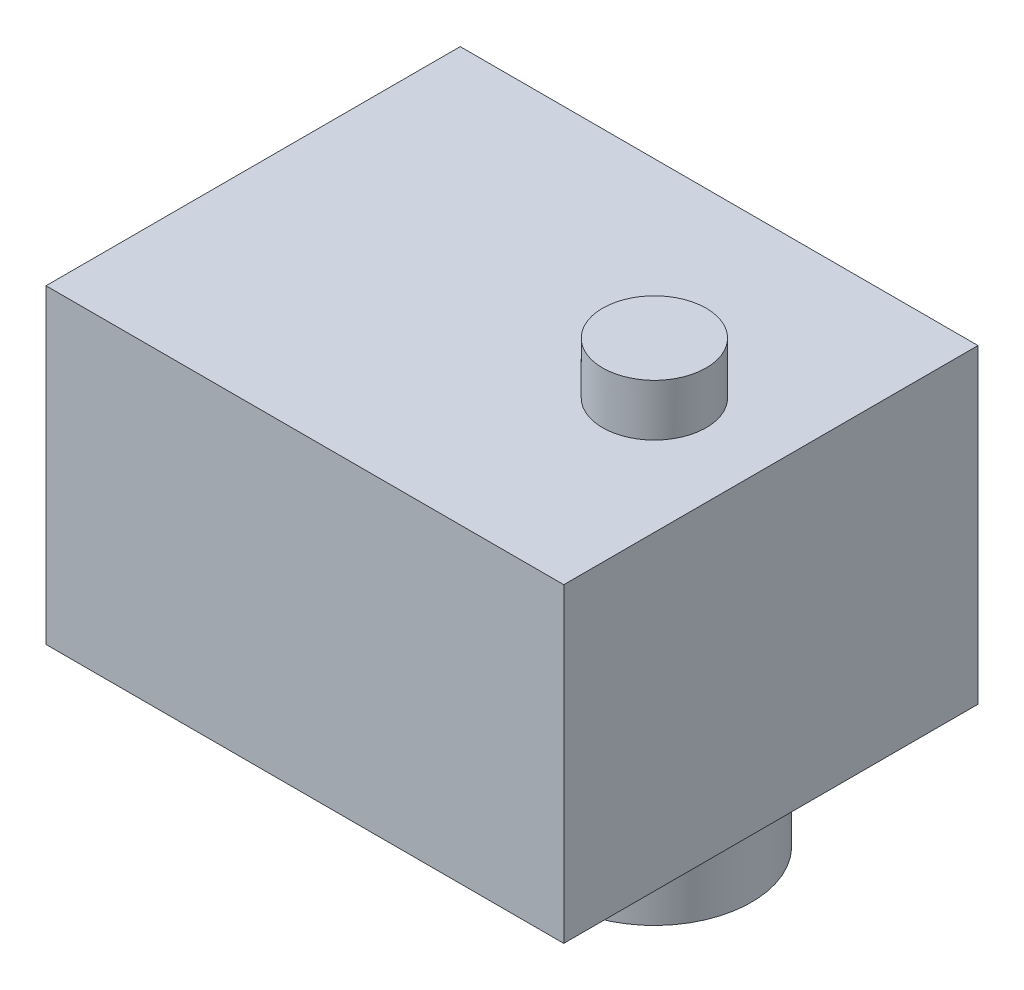
from build123d import *

# Parameters (mm, degrees)
SKETCH_1_W      = 20
SKETCH_1_H      = 16
EXTRUDE_1_DEPTH = 12
SKETCH_2_R      = 2
EXTRUDE_2_DEPTH = 2
SKETCH_3_R      = 3.75
EXTRUDE_3_DEPTH = 3
SKETCH_4_R      = 2
EXTRUDE_4_DEPTH = 2
EXTRUDE_4_TAPER = 30


with BuildPart() as part:
    # Эскиз1 → Бобышка-Вытянуть1 (new body)
    with BuildSketch(Plane(origin=(0, 0, 0), x_dir=(1, 0, 0), z_dir=(0, 1, 0))):
        with Locations((10, 8)):
            Rectangle(SKETCH_1_W, SKETCH_1_H)
    extrude(amount=EXTRUDE_1_DEPTH)

    # Эскиз2 → Бобышка-Вытянуть2 (add)
    with BuildSketch(Plane(origin=(0, 12, 0), x_dir=(1, 0, 0), z_dir=(0, 1, 0))):
        with Locations(Location((15.5, 8, 0), (0, 0, 90))):
            Circle(SKETCH_2_R)
    extrude(amount=EXTRUDE_2_DEPTH)

    # Эскиз3 → Бобышка-Вытянуть3 (add)
    with BuildSketch(Plane.XZ):
        with Locations(Location((15.5, -8, 0), (0, 0, 270))):
            Circle(SKETCH_3_R)
    extrude(amount=EXTRUDE_3_DEPTH)

    # Эскиз4 → Бобышка-Вытянуть4 (add)
    with BuildSketch(Plane.XZ.offset(3)):
        with Locations(Location((15.5, -8, 0), (0, 0, 270))):
            Circle(SKETCH_4_R)
    extrude(amount=EXTRUDE_4_DEPTH, taper=EXTRUDE_4_TAPER)


solid = part.part
